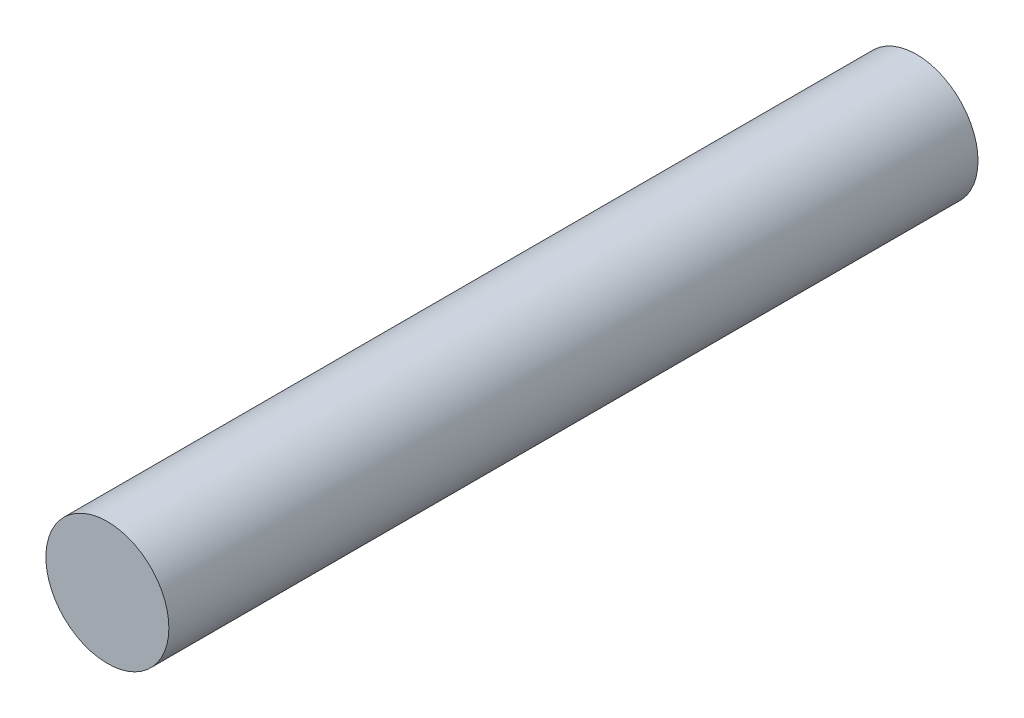
from build123d import *

# Parameters (mm, degrees)
SKETCH1_R           = 19
BOSS_EXTRUDE1_DEPTH = 250


with BuildPart() as part:
    # Sketch1 → Boss-Extrude1 (new body)
    with BuildSketch(Plane.XY):
        Circle(SKETCH1_R)
    extrude(amount=BOSS_EXTRUDE1_DEPTH)


solid = part.part
